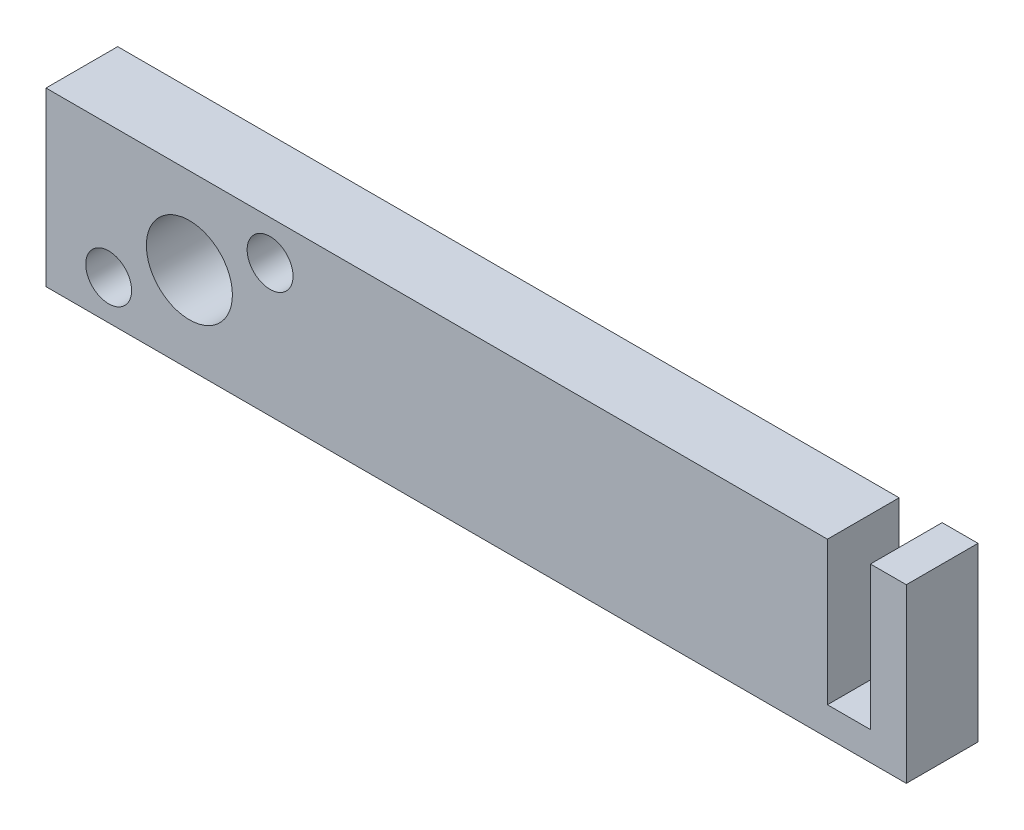
from build123d import *

# Parameters (mm, degrees)
SKETCH_1_R      = 3
SKETCH_1_R_2    = 1.6
EXTRUDE_1_DEPTH = 5


with BuildPart() as part:
    # ｽｹｯﾁ1 → ﾎﾞｽ - 押し出し1 (new body)
    with BuildSketch(Plane.XY):
        Polygon((0, -6), (50, -6), (50, 6), (47.5, 6), (47.5, -4), (44.5, -4), (44.5, 6), (-10, 6), (-10, -6), align=None)
        Circle(SKETCH_1_R, mode=Mode.SUBTRACT)
        with Locations((5.629165125, 3.25)):
            Circle(SKETCH_1_R_2, mode=Mode.SUBTRACT)
        with Locations((-5.629165125, -3.25)):
            Circle(SKETCH_1_R_2, mode=Mode.SUBTRACT)
    extrude(amount=EXTRUDE_1_DEPTH)


solid = part.part
